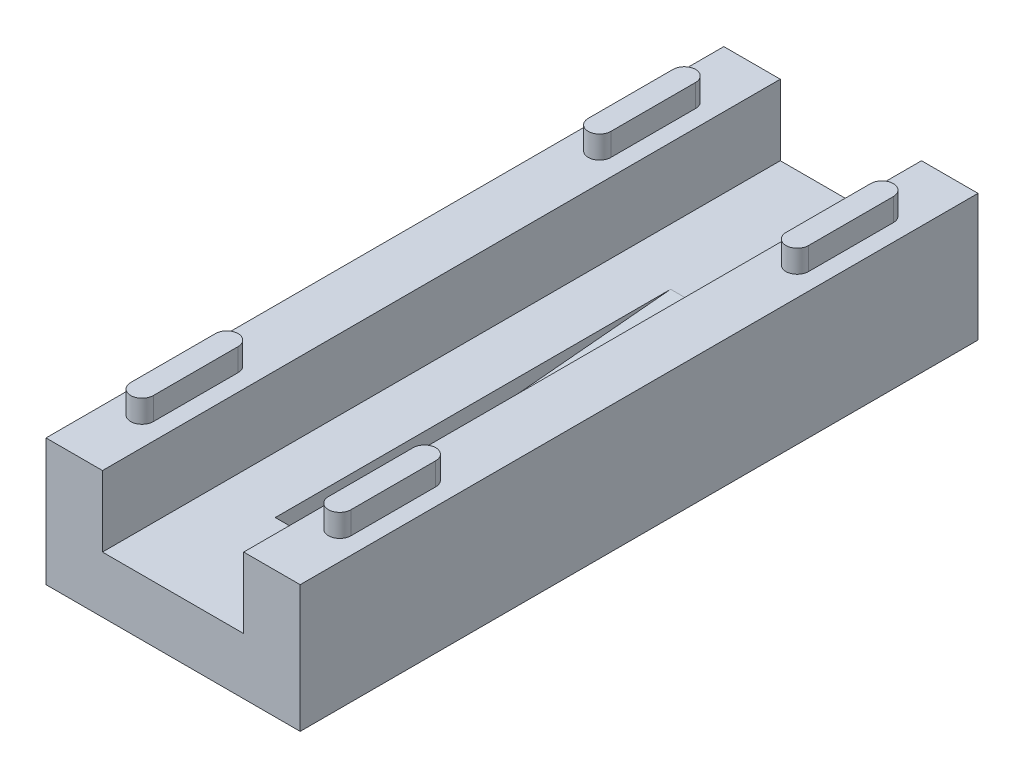
from build123d import *

# Parameters (mm, degrees)
BOSS_EXTRUDE1_DEPTH     = 120
CUT_EXTRUDE1_DEPTH      = 2.5
CUT_EXTRUDE1_DEPTH_BACK = 2.5
BOSS_EXTRUDE2_DEPTH     = 4
MIRROR2_COPY_1_DEPTH    = 4


with BuildPart() as part:
    # Sketch1 → Boss-Extrude1 (new body)
    with BuildSketch(Plane.XY):
        Polygon((-12.5, 12.5), (-22.5, 12.5), (-22.5, -10), (22.5, -10), (22.5, 12.5), (12.5, 12.5), (12.5, 0), (-12.5, 0), align=None)
    extrude(amount=BOSS_EXTRUDE1_DEPTH)

    # Sketch2 → Cut-Extrude1 (cut, two sides: drawn at the far end of the back side and taken through both)
    with BuildSketch(Plane(origin=(0, 0, 0), x_dir=(0, 0, -1), z_dir=(1, 0, 0)).offset(-CUT_EXTRUDE1_DEPTH_BACK)):
        Polygon((-29.416511254, 0), (-99.416511254, 0), (-99.416511254, -6.5), align=None)
    extrude(amount=CUT_EXTRUDE1_DEPTH + CUT_EXTRUDE1_DEPTH_BACK, mode=Mode.SUBTRACT)

    # Sketch3 → Boss-Extrude2 (add)
    with BuildSketch(Plane(origin=(0, 12.5, 0), x_dir=(1, 0, 0), z_dir=(0, 1, 0))):
        with BuildLine():
            Line((-19.5, -108), (-19.5, -93))
            ThreePointArc((-19.5, -93), (-17.5, -91), (-15.5, -93))
            Line((-15.5, -93), (-15.5, -108))
            ThreePointArc((-15.5, -108), (-17.5, -110), (-19.5, -108))
        make_face()
    boss_extrude2 = extrude(amount=BOSS_EXTRUDE2_DEPTH)

    # Mirror1: Boss-Extrude2 across plane
    add(boss_extrude2.mirror(Plane(origin=(0, 0, 0), x_dir=(0, 0, 1), z_dir=(1, 0, 0))))

    # Mirror2: Boss-Extrude2 across plane
    add(boss_extrude2.mirror(Plane(origin=(0, 0, 60), x_dir=(1, 0, 0), z_dir=(0, 0, -1))))

    # Mirror2 copy 1 sketch → Mirror2 copy 1 (add)
    with BuildSketch(Plane(origin=(0, 12.5, 120), x_dir=(-1, 0, 0), z_dir=(0, 1, 0))):
        with BuildLine():
            Line((-19.5, -108), (-19.5, -93))
            ThreePointArc((-19.5, -93), (-17.5, -91), (-15.5, -93))
            Line((-15.5, -93), (-15.5, -108))
            ThreePointArc((-15.5, -108), (-17.5, -110), (-19.5, -108))
        make_face()
    extrude(amount=MIRROR2_COPY_1_DEPTH)


solid = part.part
